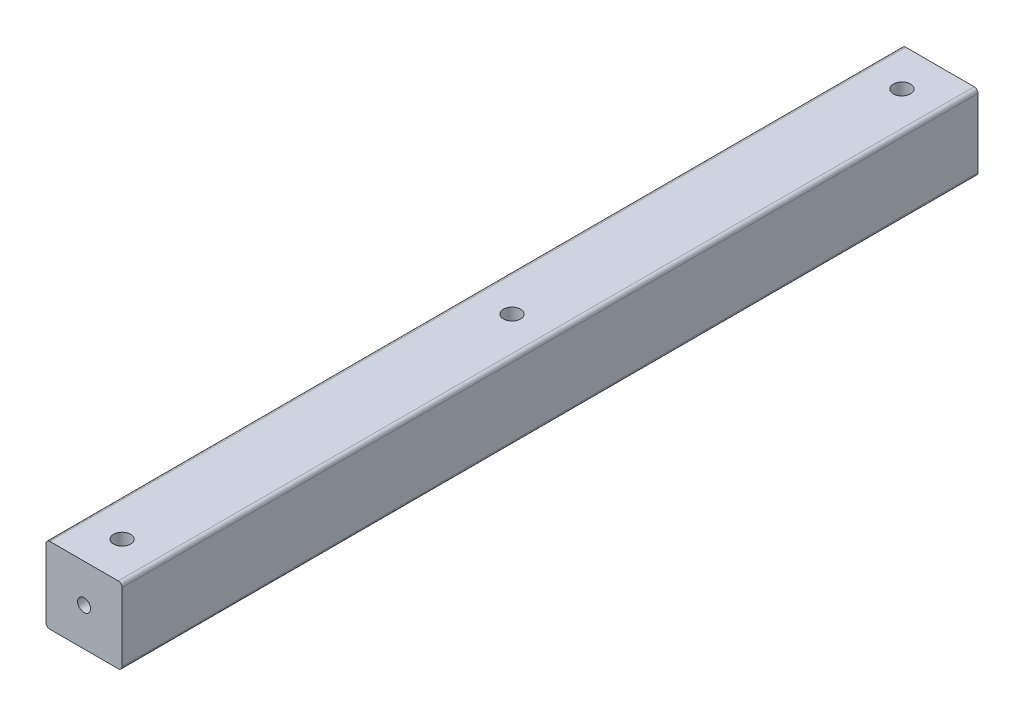
from build123d import *

# Parameters (mm, degrees)
SKETCH1_W                                           = 40
SKETCH1_H                                           = 40
SKETCH1_R                                           = 2.5
BOSS_EXTRUDE1_DEPTH                                 = 225
FILLET1_R                                           = 2
CBORE_FOR_M8_HEX_SOCKET_HEAD_CAP_SCREW1_D           = 9
CBORE_FOR_M8_HEX_SOCKET_HEAD_CAP_SCREW1_CBORE_D     = 15
CBORE_FOR_M8_HEX_SOCKET_HEAD_CAP_SCREW1_CBORE_DEPTH = 8.6


with BuildPart() as part:
    # Sketch1 → Boss-Extrude1 (new, symmetric)
    with BuildSketch(Plane.XY):
        Rectangle(SKETCH1_W, SKETCH1_H)
        Circle(SKETCH1_R, mode=Mode.SUBTRACT)
    extrude(amount=BOSS_EXTRUDE1_DEPTH, both=True)

    # Fillet1
    fillet1_edges = [part.edges().sort_by_distance(p)[0] for p in [
        (20, -20, 0),
        (-20, -20, 0),
        (-20, 20, 0),
        (20, 20, 0),
    ]]
    fillet(fillet1_edges, radius=FILLET1_R)

    # CBORE for M8 Hex Socket Head Cap Screw1 (through all)
    with Locations(Plane(origin=(0, -20, 0), x_dir=(-1, 0, 0), z_dir=(0, -1, 0))):
        with Locations((0, 500), (0, 0), (0, -500), (0, 205), (0, -205)):
            CounterBoreHole(CBORE_FOR_M8_HEX_SOCKET_HEAD_CAP_SCREW1_D / 2, CBORE_FOR_M8_HEX_SOCKET_HEAD_CAP_SCREW1_CBORE_D / 2, CBORE_FOR_M8_HEX_SOCKET_HEAD_CAP_SCREW1_CBORE_DEPTH)

    # Sketch9 → M8x1.25 Tapped Hole1 (revolve, cut)
    with BuildSketch(Plane(origin=(0, 0, 225), x_dir=(0, -1, 0), z_dir=(1, 0, 0))):
        Polygon((0, 0), (0, 29.792926105), (3.4, 27.75), (3.4, 0), align=None)
    m8x1_25_tapped_hole1 = revolve(axis=Axis((0, 0, 231.35), (0, 0, -1)), mode=Mode.SUBTRACT)

    # Mirror1: M8x1.25 Tapped Hole1 across plane
    add(m8x1_25_tapped_hole1.mirror(Plane.XY), mode=Mode.SUBTRACT)


solid = part.part
